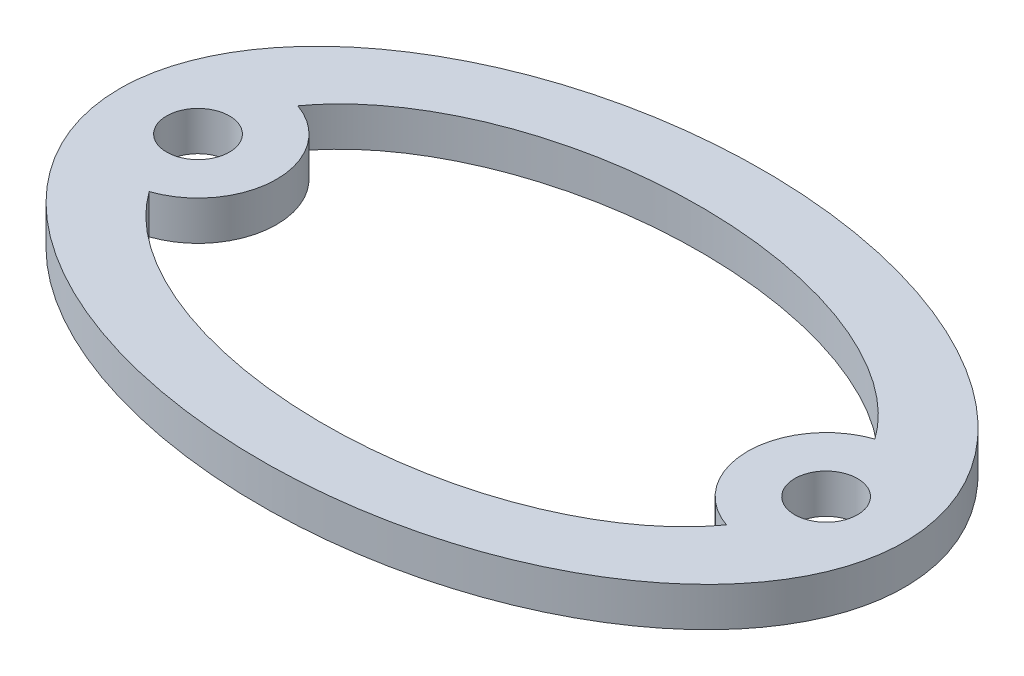
from build123d import *

# Parameters (mm, degrees)
SKETCH1_R           = 2
BOSS_EXTRUDE1_DEPTH = 2.5


with BuildPart() as part:
    # Sketch1 → Boss-Extrude1 (new body)
    with BuildSketch(Plane(origin=(0, 0, 0), x_dir=(1, 0, 0), z_dir=(0, 1, 0))):
        with BuildLine():
            add(Edge.make_bspline(
                [(-25, 0), (-25, -27.712812921), (12.5, -13.856406461), (50, 0), (12.5, 13.856406461), (-25, 27.712812921), (-25, 0)],
                knots=[0, 0, 0, 2.094395102, 2.094395102, 4.188790205, 4.188790205, 6.283185307, 6.283185307, 6.283185307], degree=2, weights=[1, 0.5, 1, 0.5, 1, 0.5, 1]))
        make_face()
        with Locations(Location((20, 0, 0), (0, 0, 270))):
            Circle(SKETCH1_R, mode=Mode.SUBTRACT)
        with BuildLine():
            ThreePointArc((18.380462324, 4.730443712), (15, 0), (18.380462324, -4.730443712))
            add(Edge.make_bspline(
                [(-18.380462324, -4.730443712), (0, -30.441119007), (18.380462324, -4.730443712)],
                knots=[3.546793818, 3.546793818, 3.546793818, 5.877984143, 5.877984143, 5.877984143], degree=2, weights=[1, 0.394203643, 1]))
            ThreePointArc((-18.380462324, -4.730443712), (-15, 0), (-18.380462324, 4.730443712))
            add(Edge.make_bspline(
                [(18.380462324, 4.730443712), (0, 30.441119007), (-18.380462324, 4.730443712)],
                knots=[0.405201164, 0.405201164, 0.405201164, 2.73639149, 2.73639149, 2.73639149], degree=2, weights=[1, 0.394203643, 1]))
        make_face(mode=Mode.SUBTRACT)
        with Locations(Location((-20, 0, 0), (0, 0, 270))):
            Circle(SKETCH1_R, mode=Mode.SUBTRACT)
    extrude(amount=BOSS_EXTRUDE1_DEPTH)


solid = part.part
